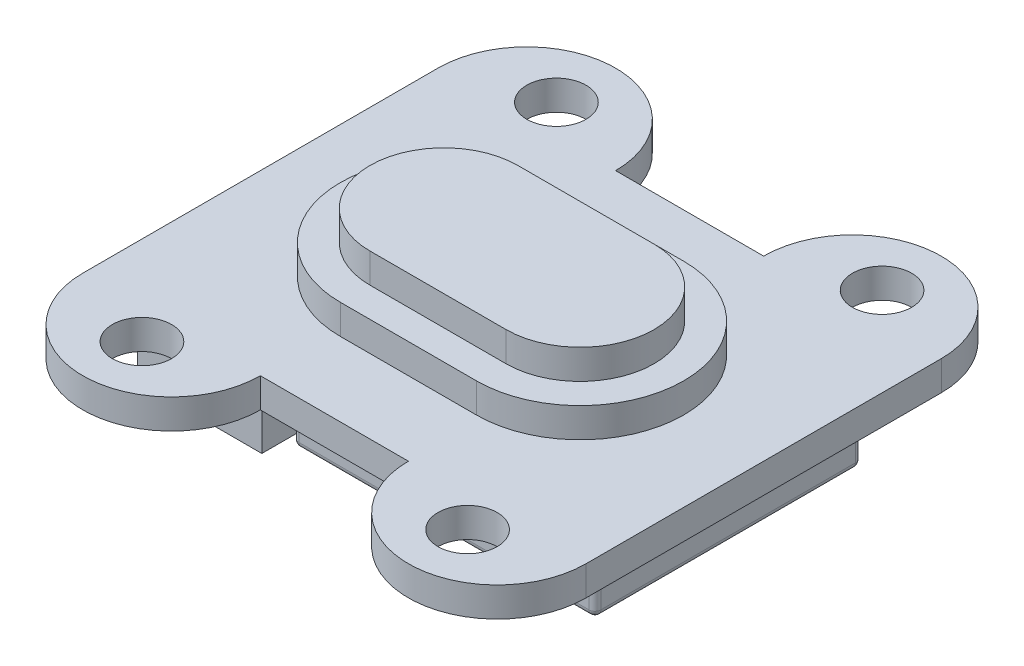
from build123d import *

# Parameters (mm, degrees)
SKETCH_1_R      = 1
EXTRUDE_1_DEPTH = 1
EXTRUDE_2_DEPTH = 1
EXTRUDE_3_DEPTH = 2
SKETCH_5_W      = 10.2
SKETCH_5_H      = 9
EXTRUDE_4_DEPTH = 2
SKETCH_5_3_W    = 4.2
SKETCH_5_3_H    = 8.3
EXTRUDE_5_DEPTH = 3.1
SHELL_1_T       = -0.5
SKETCH_6_W      = 0.2
SKETCH_6_H      = 0.2
EXTRUDE_6_DEPTH = 2
FILLET_1_R      = 0.2


with BuildPart() as part:
    # 草图1 → 凸台-拉伸1 (new body)
    with BuildSketch(Plane(origin=(0, 0, 0), x_dir=(1, 0, 0), z_dir=(0, 1, 0))):
        with BuildLine():
            ThreePointArc((2.5, -6), (5.5, -9), (8.5, -6))
            Line((8.5, -6), (8.5, 6))
            ThreePointArc((8.5, 6), (5.5, 9), (2.5, 6))
            Line((2.5, 6), (-2.5, 6))
            ThreePointArc((-2.5, 6), (-5.5, 9), (-8.5, 6))
            Line((-8.5, 6), (-8.5, -6))
            ThreePointArc((-8.5, -6), (-5.5, -9), (-2.5, -6))
            Line((-2.5, -6), (2.5, -6))
        make_face()
        with Locations((5.5, -7)):
            Circle(SKETCH_1_R, mode=Mode.SUBTRACT)
        with Locations((-5.5, -7)):
            Circle(SKETCH_1_R, mode=Mode.SUBTRACT)
        with Locations((-5.5, 7)):
            Circle(SKETCH_1_R, mode=Mode.SUBTRACT)
        with Locations((5.5, 7)):
            Circle(SKETCH_1_R, mode=Mode.SUBTRACT)
    extrude(amount=EXTRUDE_1_DEPTH)

    # 草图3 → 凸台-拉伸2 (add)
    with BuildSketch(Plane(origin=(0, 1, 0), x_dir=(1, 0, 0), z_dir=(0, 1, 0))):
        with BuildLine():
            Line((2.3, 3.5), (-2.3, 3.5))
            ThreePointArc((-2.3, 3.5), (-5.8, 0), (-2.3, -3.5))
            Line((-2.3, -3.5), (2.3, -3.5))
            ThreePointArc((2.3, -3.5), (5.8, 0), (2.3, 3.5))
        make_face()
        with BuildLine():
            ThreePointArc((-2.3, -2.5), (-4.8, 0), (-2.3, 2.5))
            Line((-2.3, 2.5), (2.3, 2.5))
            ThreePointArc((2.3, 2.5), (4.8, 0), (2.3, -2.5))
            Line((2.3, -2.5), (-2.3, -2.5))
        make_face(mode=Mode.SUBTRACT)
    extrude(amount=EXTRUDE_2_DEPTH)

    # 草图3<3> → 凸台-拉伸3 (add)
    with BuildSketch(Plane(origin=(0, 1, 0), x_dir=(1, 0, 0), z_dir=(0, 1, 0))):
        with BuildLine():
            Line((-2.3, 2.5), (2.3, 2.5))
            ThreePointArc((2.3, 2.5), (4.8, 0), (2.3, -2.5))
            Line((2.3, -2.5), (-2.3, -2.5))
            ThreePointArc((-2.3, -2.5), (-4.8, 0), (-2.3, 2.5))
        make_face()
    extrude(amount=EXTRUDE_3_DEPTH)

    # 草图5 → 凸台-拉伸4 (add)
    with BuildSketch(Plane.XZ):
        with Locations((2.2, 0)):
            Rectangle(SKETCH_5_W, SKETCH_5_H)
    extrude(amount=EXTRUDE_4_DEPTH)



with BuildPart() as body_2:
    # 草图5<3> → 凸台-拉伸5 (new body)
    with BuildSketch(Plane.XZ):
        with Locations((-6.4, 0)):
            Rectangle(SKETCH_5_3_W, SKETCH_5_3_H)
    extrude(amount=EXTRUDE_5_DEPTH)

    # 抽壳1
    shell_1_openings = [body_2.faces().sort_by_distance(p)[0] for p in [
        (-8.5, -1.55, 0),
    ]]
    offset(amount=SHELL_1_T, openings=shell_1_openings, kind=Kind.INTERSECTION)


with BuildPart() as part_1:
    add(part.part)

    add(body_2.part)  # 凸台-拉伸6 merges body 2
    # 草图6 → 凸台-拉伸6 (add)
    with BuildSketch(Plane.ZY.offset(4.8)):
        with Locations((1.5, -2)):
            Rectangle(SKETCH_6_W, SKETCH_6_H)
        with Locations((2.5, -2)):
            Rectangle(SKETCH_6_W, SKETCH_6_H)
        with Locations((0.5, -2)):
            Rectangle(SKETCH_6_W, SKETCH_6_H)
        with Locations((-0.5, -2)):
            Rectangle(SKETCH_6_W, SKETCH_6_H)
        with Locations((-1.5, -2)):
            Rectangle(SKETCH_6_W, SKETCH_6_H)
        with Locations((-2.5, -2)):
            Rectangle(SKETCH_6_W, SKETCH_6_H)
    extrude(amount=EXTRUDE_6_DEPTH)

    # 圆角1
    fillet_1_edges = [part_1.edges().sort_by_distance(p)[0] for p in [
        (-2.9, -2, 0),
        (2.2, -2, -4.5),
        (7.3, -2, 0),
        (2.2, -2, 4.5),
        (-2.9, -1, -4.5),
        (-2.9, -1, 4.5),
        (7.3, -1, -4.5),
        (7.3, -1, 4.5),
    ]]
    fillet(fillet_1_edges, radius=FILLET_1_R)


solid = part_1.part
